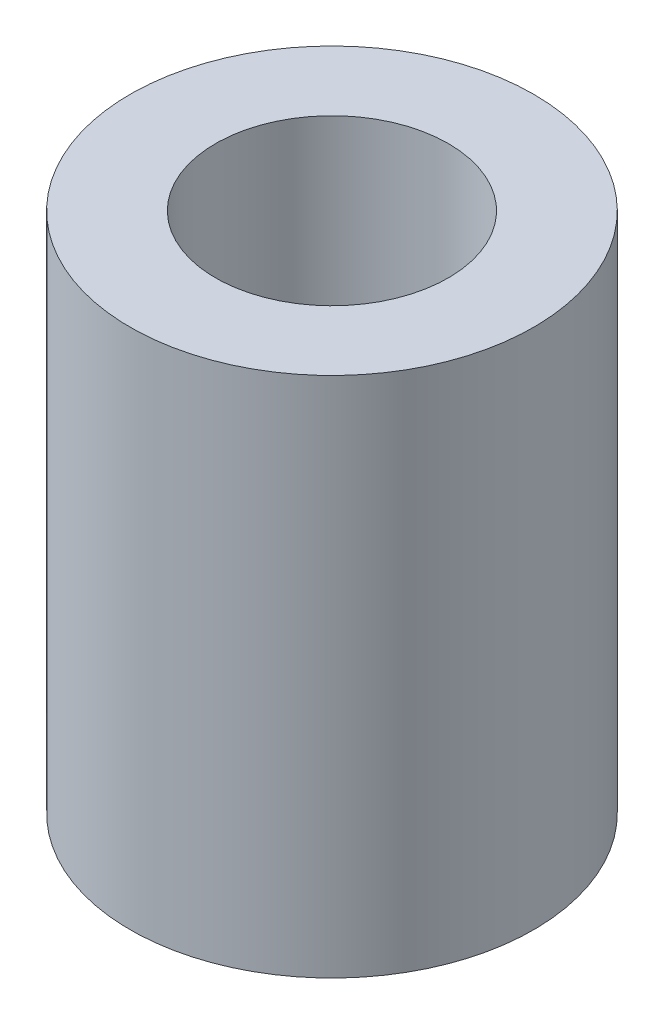
from build123d import *

# Parameters (mm, degrees)
SKETCH1_R           = 16.51
SKETCH1_R_2         = 9.525
BOSS_EXTRUDE1_DEPTH = 42.7


with BuildPart() as part:
    # Sketch1 → Boss-Extrude1 (new body)
    with BuildSketch(Plane(origin=(0, 0, 0), x_dir=(1, 0, 0), z_dir=(0, 1, 0))):
        with Locations(Location((0, 0, 0), (0, 0, 90))):
            Circle(SKETCH1_R)
        with Locations(Location((0, 0, 0), (0, 0, 90))):
            Circle(SKETCH1_R_2, mode=Mode.SUBTRACT)
    extrude(amount=BOSS_EXTRUDE1_DEPTH)


solid = part.part
